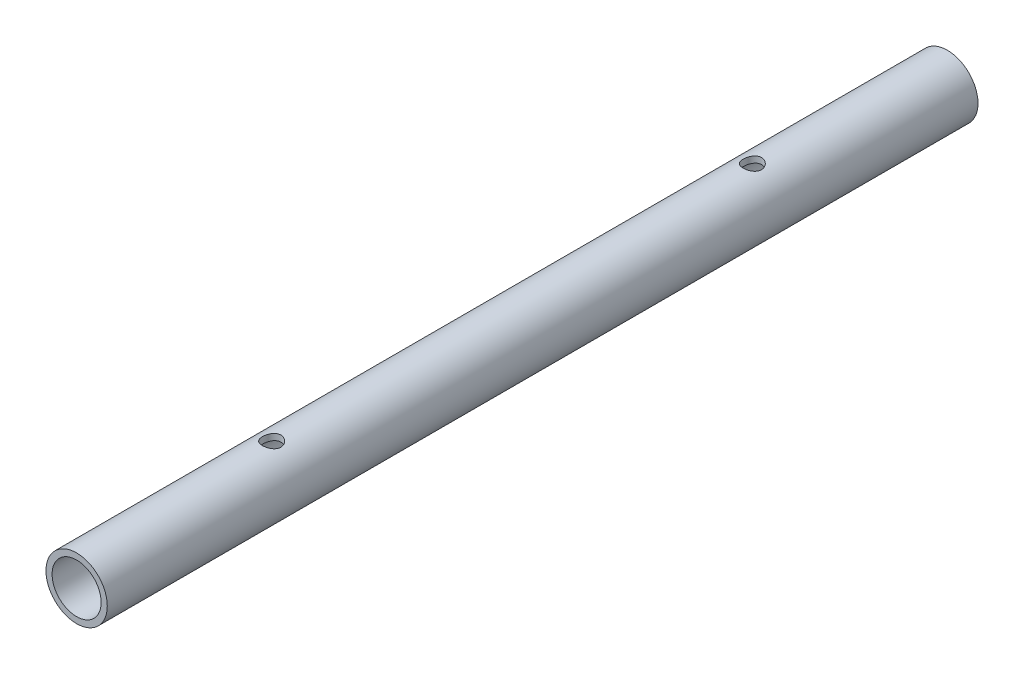
from build123d import *

# Parameters (mm, degrees)
SKETCH1_R               = 5
BOSS_EXTRUDE1_DEPTH     = 141.96
CUT_EXTRUDE1_REACH      = 144.136
SKETCH2_R               = 4
CUT_EXTRUDE2_DEPTH      = 143.135996848
CUT_EXTRUDE2_DEPTH_BACK = 143.135996848
SKETCH5_R               = 1.5


with BuildPart() as part:
    # Sketch1 → Boss-Extrude1 (new body)
    with BuildSketch(Plane.XY):
        with Locations(Location((0, 0, 0), (0, 0, 180))):
            Circle(SKETCH1_R)
    extrude(amount=BOSS_EXTRUDE1_DEPTH)

    # Sketch2 → Cut-Extrude1 (cut, up to next)
    with BuildSketch(Plane.XY.offset(141.96), mode=Mode.PRIVATE) as cut_extrude1_sk1:
        Circle(SKETCH2_R)
    cut_extrude1_tool1 = extrude(cut_extrude1_sk1.sketch, amount=-CUT_EXTRUDE1_REACH, mode=Mode.PRIVATE) & part.part
    add(cut_extrude1_tool1.solids().sort_by_distance((0, 0, 141.96))[0], mode=Mode.SUBTRACT)

    # Sketch5 → Cut-Extrude2 (cut, two sides: drawn at the far end of the back side and taken through both)
    with BuildSketch(Plane(origin=(0, 0, 0), x_dir=(1, 0, 0), z_dir=(0, 1, 0)).offset(-CUT_EXTRUDE2_DEPTH_BACK)):
        with Locations(Location((0, -31.799, 0), (0, 0, 270))):
            Circle(SKETCH5_R)
        with Locations(Location((0, -110.161, 0), (0, 0, 270))):
            Circle(SKETCH5_R)
    extrude(amount=CUT_EXTRUDE2_DEPTH + CUT_EXTRUDE2_DEPTH_BACK, mode=Mode.SUBTRACT)


solid = part.part
